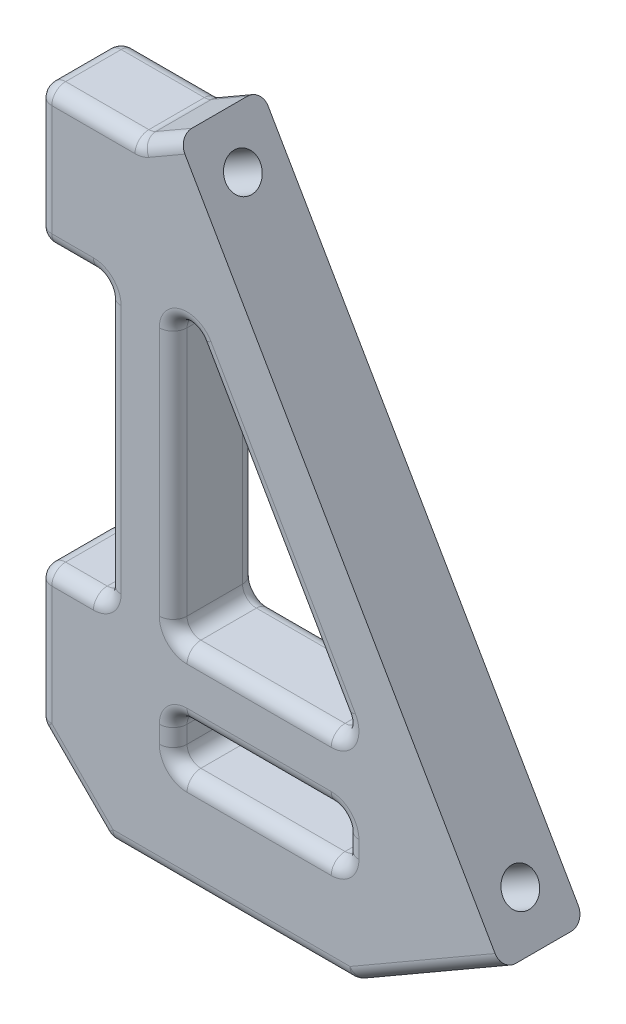
from build123d import *

# Parameters (mm, degrees)
EXTRUDE_1_DEPTH     = 6
SKETCH_2_W          = 12.392304845
SKETCH_2_H          = 3.248711306
CUT_EXTRUDE_1_DEPTH = 6
SKETCH_3_R          = 1.25
CUT_EXTRUDE_2_DEPTH = 6
SKETCH_4_R          = 1.25
CUT_EXTRUDE_3_DEPTH = 6
SKETCH_5_R          = 1.25
CUT_EXTRUDE_4_DEPTH = 6
FILLET_1_R          = 1
FILLET_2_R          = 1


with BuildPart() as part:
    # Эскиз1 → Бобышка-Вытянуть1 (new body)
    with BuildSketch(Plane.XY):
        with BuildLine():
            Line((5, 0), (0, 5))
            Line((0, 5), (0, 15))
            Line((0, 15), (5, 15))
            Line((5, 15), (5, 35))
            Line((5, 35), (0, 35))
            Line((0, 35), (0, 45))
            Line((0, 45), (7, 45))
            ThreePointArc((7, 45), (7.258819045, 45.034074174), (7.5, 45.133974596))
            Line((7.5, 45.133974596), (10.098076211, 46.633974596))
            Line((10.098076211, 46.633974596), (33.458647797, 6.172277717))
            Line((33.458647797, 6.172277717), (23, 0.133974596))
            ThreePointArc((23, 0.133974596), (22.758819045, 0.034074174), (22.5, 0))
            Line((22.5, 0), (5, 0))
        make_face()
    extrude(amount=EXTRUDE_1_DEPTH)

    # Эскиз2 → Вырез-Вытянуть1 (cut)
    with BuildSketch(Plane.XY.offset(6)):
        with BuildLine():
            Line((9.751288694, 34), (9.751288694, 15))
            Line((9.751288694, 15), (21.143593539, 15))
            ThreePointArc((21.143593539, 15), (22.009618943, 15.5), (22.009618943, 16.5))
            Line((22.009618943, 16.5), (11.617314098, 34.5))
            ThreePointArc((11.617314098, 34.5), (10.492469649, 34.965925826), (9.751288694, 34))
        make_face()
        with Locations((15.947441117, 8.624355653)):
            Rectangle(SKETCH_2_W, SKETCH_2_H)
    extrude(amount=-CUT_EXTRUDE_1_DEPTH, mode=Mode.SUBTRACT)

    # Эскиз3 → Вырез-Вытянуть2 (cut)
    with BuildSketch(Plane.ZY):
        with Locations((3, 40)):
            Circle(SKETCH_3_R)
        with Locations((3, 10)):
            Circle(SKETCH_3_R)
    extrude(amount=-CUT_EXTRUDE_2_DEPTH, mode=Mode.SUBTRACT)

    # Эскиз4 → Вырез-Вытянуть3 (cut)
    with BuildSketch(Plane.XZ):
        with Locations((13.75, 3)):
            Circle(SKETCH_4_R)
    extrude(amount=-CUT_EXTRUDE_3_DEPTH, mode=Mode.SUBTRACT)

    # Эскиз5 → Вырез-Вытянуть4 (cut)
    with BuildSketch(Plane(origin=(27.766660498, 16.031088913, 0), x_dir=(0, 0, -1), z_dir=(0.8660254037844382, 0.5000000000000007, 0))):
        with Locations(Location((-3, 31.976596989, 0), (0, 0, 90))):
            Circle(SKETCH_5_R)
        with Locations(Location((-3, -8.023403011, 0), (0, 0, 90))):
            Circle(SKETCH_5_R)
    extrude(amount=-CUT_EXTRUDE_4_DEPTH, mode=Mode.SUBTRACT)

    # Скругление1
    fillet_1_edges = [part.edges().sort_by_distance(p)[0] for p in [
        (5, 0, 3),
        (0, 5, 3),
        (0, 15, 3),
        (5, 15, 3),
        (5, 35, 3),
        (0, 35, 3),
        (0, 45, 3),
        (9.751288694, 15, 3),
        (9.751288694, 7, 3),
        (9.751288694, 10.248711306, 3),
        (22.143593539, 10.248711306, 3),
        (22.143593539, 7, 3),
    ]]
    fillet(fillet_1_edges, radius=FILLET_1_R)

    # Скругление2
    fillet_2_edges = [part.edges().sort_by_distance(p)[0] for p in [
        (28.229323898, 3.153126157, 6),
        (15.947441117, 15, 0),
        (13.957106781, 0, 0),
        (13.957106781, 0, 6),
        (2.5, 2.5, 0),
        (0, 9.707106781, 0),
        (2.5, 15, 0),
        (5, 25, 0),
        (2.5, 35, 0),
        (0, 40, 0),
        (0.292893219, 35.292893219, 0),
        (0.292893219, 44.707106781, 0),
        (0.292893219, 14.707106781, 0),
        (0.076120467, 5.03153013, 0),
        (5.03153013, 0.076120467, 0),
        (2.5, 2.5, 6),
        (0, 40, 6),
        (2.5, 35, 6),
        (5, 25, 6),
        (2.5, 15, 6),
        (0, 9.707106781, 6),
        (0.292893219, 35.292893219, 6),
        (0.292893219, 44.707106781, 6),
        (0.292893219, 14.707106781, 6),
        (0.076120467, 5.03153013, 6),
        (5.03153013, 0.076120467, 6),
        (21.850700321, 7.292893219, 6),
        (21.850700321, 7.292893219, 0),
        (21.850700321, 9.955818087, 6),
        (21.850700321, 9.955818087, 0),
        (10.044181913, 7.292893219, 6),
        (10.044181913, 7.292893219, 0),
        (10.044181913, 9.955818087, 6),
        (10.044181913, 9.955818087, 0),
        (10.044181913, 15.292893219, 6),
        (10.044181913, 15.292893219, 0),
        (4.707106781, 15.292893219, 0),
        (4.707106781, 15.292893219, 6),
        (4.707106781, 34.707106781, 0),
        (4.707106781, 34.707106781, 6),
        (4, 45, 0),
        (7.258819045, 45.034074174, 0),
        (8.799038106, 45.883974596, 0),
        (28.229323898, 3.153126157, 0),
        (8.799038106, 45.883974596, 6),
        (22.758819045, 0.034074174, 0),
        (7.258819045, 45.034074174, 6),
        (4, 45, 6),
        (9.751288694, 25, 0),
        (10.492469649, 34.965925826, 0),
        (16.813466521, 25.5, 0),
        (22.009618943, 15.5, 0),
        (22.009618943, 15.5, 6),
        (16.813466521, 25.5, 6),
        (10.492469649, 34.965925826, 6),
        (9.751288694, 25, 6),
        (22.758819045, 0.034074174, 6),
        (22.143593539, 8.624355653, 6),
        (22.143593539, 8.624355653, 0),
        (15.947441117, 7, 6),
        (15.947441117, 7, 0),
        (15.947441117, 10.248711306, 6),
        (15.947441117, 10.248711306, 0),
        (9.751288694, 8.624355653, 6),
        (9.751288694, 8.624355653, 0),
        (15.947441117, 15, 6),
    ]]
    fillet(fillet_2_edges, radius=FILLET_2_R)


solid = part.part
